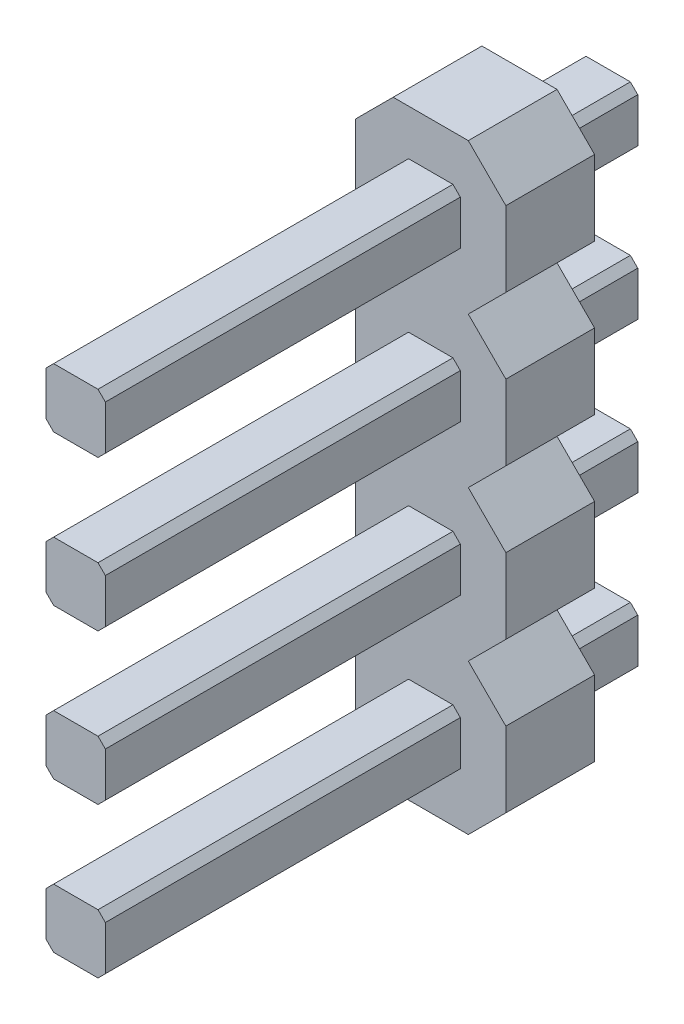
from build123d import *

# Parameters (mm, degrees)
BOSS_EXTRUDE1_DEPTH      = 1.5
BOSS_EXTRUDE2_DEPTH      = 6
BOSS_EXTRUDE2_DEPTH_BACK = 3


with BuildPart() as part:
    # Sketch1 → Boss-Extrude1 (new body)
    with BuildSketch(Plane.XY):
        Polygon((-0.635, 10.16), (0.635, 10.16), (1.27, 9.525), (1.27, 8.255), (0.635, 7.62), (1.27, 6.985), (1.27, 5.715), (0.635, 5.08), (1.27, 4.445), (1.27, 3.175), (0.635, 2.54), (1.27, 1.905), (1.27, 0.635), (0.635, 0), (-0.635, 0), (-1.27, 0.635), (-1.27, 1.905), (-0.635, 2.54), (-1.27, 3.175), (-1.27, 4.445), (-0.635, 5.08), (-1.27, 5.715), (-1.27, 6.985), (-0.635, 7.62), (-1.27, 8.255), (-1.27, 9.525), align=None)
    extrude(amount=BOSS_EXTRUDE1_DEPTH)

    # Sketch2 → Boss-Extrude2 (add, two sides: drawn at the far end of the back side and taken through both)
    with BuildSketch(Plane.XY.offset(1.5).offset(-BOSS_EXTRUDE2_DEPTH_BACK)):
        Polygon((0.5, 9.265), (0.375, 9.39), (-0.375, 9.39), (-0.5, 9.265), (-0.5, 8.515), (-0.375, 8.39), (0.375, 8.39), (0.5, 8.515), align=None)
        Polygon((0.5, 6.725), (0.375, 6.85), (-0.375, 6.85), (-0.5, 6.725), (-0.5, 5.975), (-0.375, 5.85), (0.375, 5.85), (0.5, 5.975), align=None)
        Polygon((0.5, 4.185), (0.375, 4.31), (-0.375, 4.31), (-0.5, 4.185), (-0.5, 3.435), (-0.375, 3.31), (0.375, 3.31), (0.5, 3.435), align=None)
        Polygon((0.5, 1.645), (0.375, 1.77), (-0.375, 1.77), (-0.5, 1.645), (-0.5, 0.895), (-0.375, 0.77), (0.375, 0.77), (0.5, 0.895), align=None)
    extrude(amount=BOSS_EXTRUDE2_DEPTH + BOSS_EXTRUDE2_DEPTH_BACK)


solid = part.part
